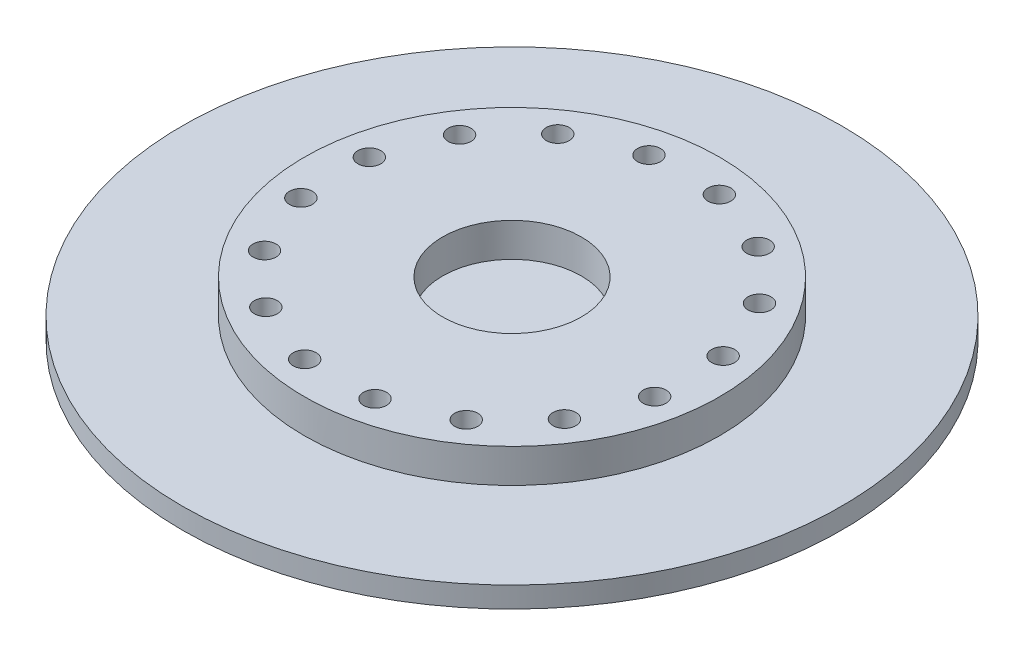
from build123d import *

# Parameters (mm, degrees)
SKETCH1_R         = 120.65
EXTRUDE1_DEPTH    = 7.62
SKETCH2_R         = 76.0000004
SKETCH2_R_2       = 25.4
EXTRUDE2_DEPTH    = 20
EXTRUDE3_DEPTH    = 1.016
EXTRUDE4_REACH    = 173.793
SKETCH8_R         = 4.2
CIRPATTERN1_COUNT = 16


with BuildPart() as part:
    # Sketch1 → Extrude1 (new body)
    with BuildSketch(Plane(origin=(0, 0, 0), x_dir=(1, 0, 0), z_dir=(0, 1, 0))):
        Circle(SKETCH1_R)
    extrude(amount=EXTRUDE1_DEPTH)

    # Sketch2 → Extrude2 (add)
    with BuildSketch(Plane.XZ):
        Circle(SKETCH2_R)
        Circle(SKETCH2_R_2, mode=Mode.SUBTRACT)
    extrude(amount=-EXTRUDE2_DEPTH)

    # Sketch5 → Extrude3 (cut)
    with BuildSketch(Plane.XZ):
        Polygon((28.869265873, -70.307862916), (27.394526953, -70.895486407), (-28.869265873, 70.307862916), (-27.394526953, 70.895486407), align=None)
    extrude(amount=-EXTRUDE3_DEPTH, mode=Mode.SUBTRACT)

    # Sketch8 → Extrude4 (cut, up to next)
    with BuildSketch(Plane.XZ, mode=Mode.PRIVATE) as extrude4_sk1:
        with Locations((-11.84499556, 64.064175482)):
            Circle(SKETCH8_R)
    extrude4_tool1 = extrude(extrude4_sk1.sketch, amount=-EXTRUDE4_REACH, mode=Mode.PRIVATE) & part.part
    extrude4 = extrude4_tool1.solids().sort_by_distance((-11.844996, 0, 64.064175))[0]
    add(extrude4, mode=Mode.SUBTRACT)

    # CirPattern1: Extrude4 ×16 about axis
    cirpattern1_axis = Axis((0, 20, 0), (0, -1, 0))
    for i in range(1, CIRPATTERN1_COUNT):
        add(extrude4.rotate(cirpattern1_axis, i * 360 / CIRPATTERN1_COUNT), mode=Mode.SUBTRACT)


solid = part.part
